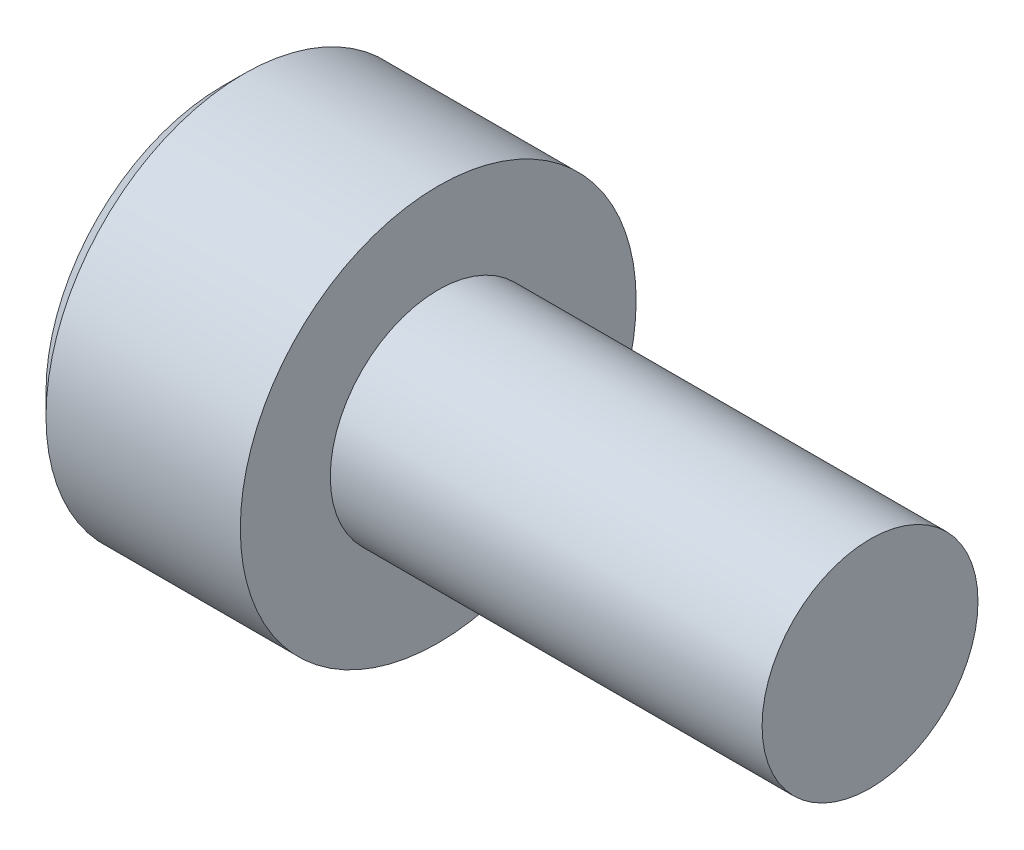
from build123d import *

# Parameters (mm, degrees)
CUT_EXTRUDE1_DEPTH = 1.3
CHAMFER1_SIZE      = 0.3


with BuildPart() as part:
    # Sketch1 → Revolve1 (revolve)
    with BuildSketch(Plane.XY, mode=Mode.PRIVATE) as revolve1_sk:
        Polygon((0, 1.5), (6, 1.5), (6, 0), (-3, 0), (-3, 2.75), (0, 2.75), align=None)
    revolve(revolve1_sk.sketch.rotate(Axis((-3, 0, 0), (1, 0, 0)), 180), axis=Axis((-3, 0, 0), (1, 0, 0)))

    # Sketch2 → Cut-Revolve1 (revolve, cut)
    with BuildSketch(Plane.XY, mode=Mode.PRIVATE) as cut_revolve1_sk:
        Polygon((-0.948924226, 0), (-1.7, 1.25), (-3, 1.25), (-3, 0), align=None)
    revolve(cut_revolve1_sk.sketch.rotate(Axis((-3, 0, 0), (1, 0, 0)), 180), axis=Axis((-3, 0, 0), (1, 0, 0)), mode=Mode.SUBTRACT)

    # Sketch3 → Cut-Extrude1 (cut)
    with BuildSketch(Plane.ZY.offset(3)):
        Polygon((1.25, 0.721687836), (0, 1.443375673), (-1.25, 0.721687836), (-1.25, -0.721687836), (0, -1.443375673), (1.25, -0.721687836), align=None)
    extrude(amount=-CUT_EXTRUDE1_DEPTH, mode=Mode.SUBTRACT)

    # Chamfer1
    chamfer1_edges = [part.edges().sort_by_distance(p)[0] for p in [
        (-3, 2.75, 0),
    ]]
    chamfer(chamfer1_edges, length=CHAMFER1_SIZE)


solid = part.part
